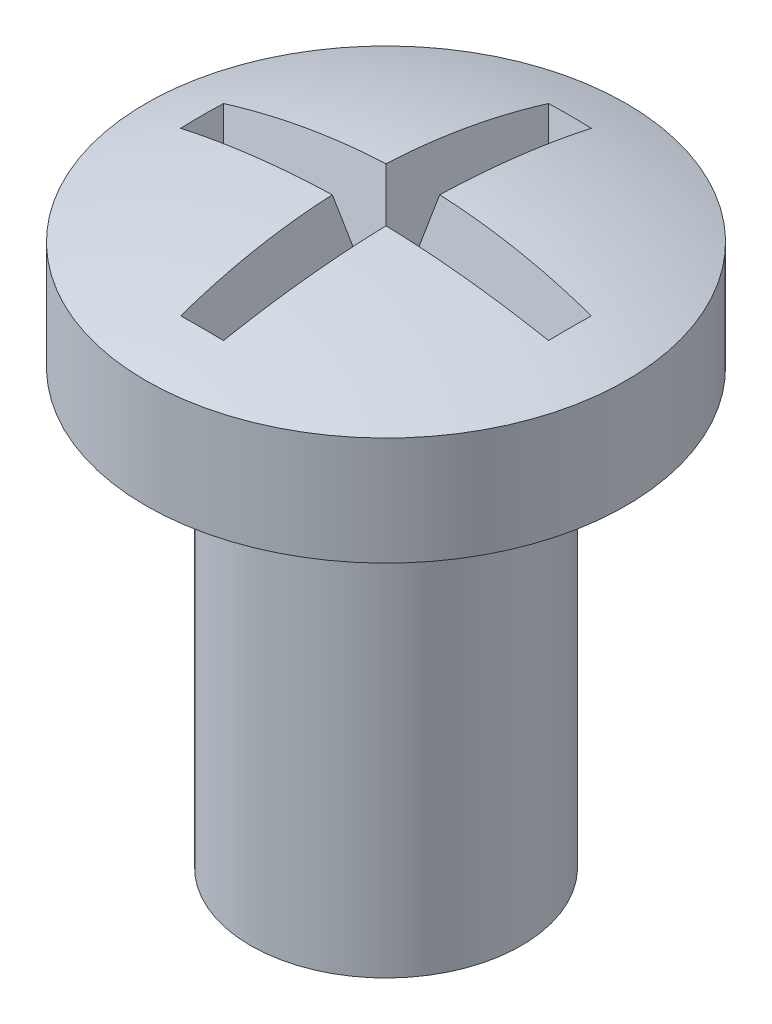
from build123d import *

# Parameters (mm, degrees)
CUT_EXTRUDE_2_DEPTH = 0.9
CUT_EXTRUDE_2_DRAFT = -13


with BuildPart() as part:
    # Эскиз1 → Повернуть1 (revolve)
    with BuildSketch(Plane.XY, mode=Mode.PRIVATE) as revolve_1_sk:
        with BuildLine():
            Line((0, 0), (-1.25, 0))
            Line((-1.25, 0), (-1.25, 4))
            Line((-1.25, 4), (-2.216535727, 4))
            Line((-2.216535727, 4), (-2.216535727, 5))
            ThreePointArc((-2.216535727, 5), (-1.125, 5.289235369), (0, 5.386612688))
            Line((0, 5.386612688), (0, 0))
        make_face()
    revolve(revolve_1_sk.sketch.rotate(Axis((0, 5.386612688, 0), (0, -1, 0)), 270), axis=Axis((0, 5.386612688, 0), (0, -1, 0)))


with BuildPart() as cut_extrude_2_tool:
    # Эскиз3 → Вырез-Вытянуть2 (with draft: the straight prism first)
    with BuildSketch(Plane(origin=(0, 5.386612688, 0), x_dir=(1, 0, 0), z_dir=(0, 1, 0))):
        Polygon((-0.25, 0.25), (-1.75, 0.25), (-1.75, -0.25), (-0.25, -0.25), (-0.25, -1.75), (0.25, -1.75), (0.25, -0.25), (1.75, -0.25), (1.75, 0.25), (0.25, 0.25), (0.25, 1.75), (-0.25, 1.75), align=None)
    extrude(amount=-CUT_EXTRUDE_2_DEPTH)
    # Вырез-Вытянуть2: the draft: its side faces are tilted about the plane it starts from
    cut_extrude_2_sides = [cut_extrude_2_tool.faces().sort_by_distance(p)[0] for p in [
        (-1, 4.936612688, -0.25),
        (-1.75, 4.936612688, 0),
        (-1, 4.936612688, 0.25),
        (-0.25, 4.936612688, 1),
        (0, 4.936612688, 1.75),
        (0.25, 4.936612688, 1),
        (1, 4.936612688, 0.25),
        (1.75, 4.936612688, 0),
        (1, 4.936612688, -0.25),
        (0.25, 4.936612688, -1),
        (0, 4.936612688, -1.75),
        (-0.25, 4.936612688, -1),
    ]]
    draft(cut_extrude_2_sides, Plane(origin=(0, 5.386612688, 0), x_dir=(1, 0, 0), z_dir=(0, 1, 0)), CUT_EXTRUDE_2_DRAFT)


with BuildPart() as part_1:
    add(part.part)

    # Вырез-Вытянуть2: cut by cut_extrude_2_tool
    add(cut_extrude_2_tool.part, mode=Mode.SUBTRACT)


solid = part_1.part
